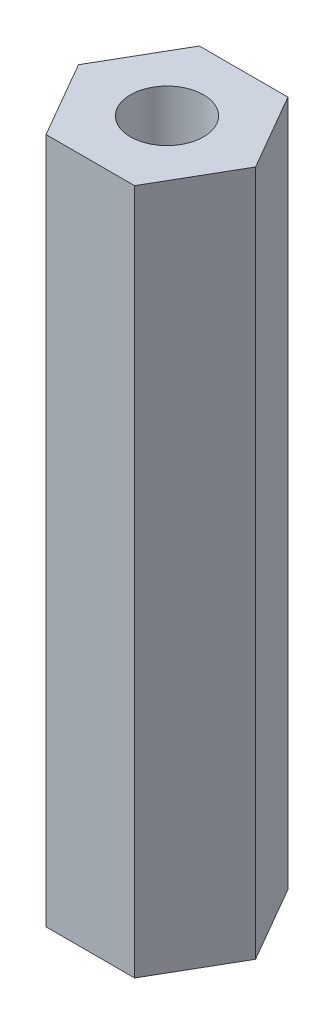
from build123d import *

# Parameters (mm, degrees)
BOSS_EXTRUDE1_DEPTH         = 31
TAP_DRILL_FOR_M4X0_7_TAP1_D = 3.3


with BuildPart() as part:
    # Sketch1 → Boss-Extrude1 (new body)
    with BuildSketch(Plane(origin=(0, 0, 0), x_dir=(1, 0, 0), z_dir=(0, 1, 0))):
        Polygon((4, 0), (2, 3.464101615), (-2, 3.464101615), (-4, 0), (-2, -3.464101615), (2, -3.464101615), align=None)
    extrude(amount=BOSS_EXTRUDE1_DEPTH)

    # Tap Drill for M4x0.7 Tap1 (through all)
    with Locations(Plane(origin=(0, 31, 0), x_dir=(1, 0, 0), z_dir=(0, 1, 0))):
        with Locations((0, 0)):
            Hole(TAP_DRILL_FOR_M4X0_7_TAP1_D / 2)


solid = part.part
